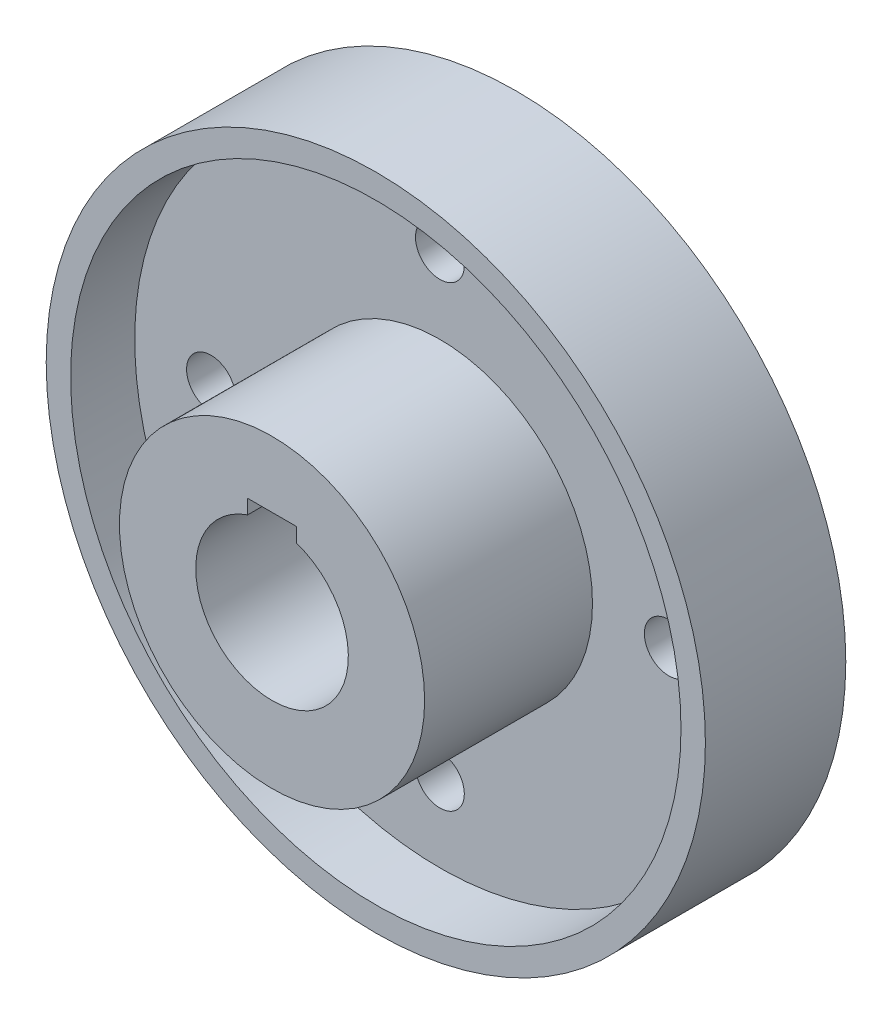
from build123d import *

# Parameters (mm, degrees)
SKETCH1_R           = 50
BOSS_EXTRUDE1_DEPTH = 80
SKETCH2_R           = 108
SKETCH2_R_2         = 50
SKETCH2_R_3         = 8
BOSS_EXTRUDE3_DEPTH = 46
BOSS_EXTRUDE4_START = 5
SKETCH3_R           = 50
BOSS_EXTRUDE4_DEPTH = 5
CHAMFER1_SIZE       = 2
CUT_EXTRUDE1_START  = -21
SKETCH6_R           = 100
SKETCH6_R_2         = 50
CUT_EXTRUDE1_DEPTH  = 21


with BuildPart() as part:
    # Sketch1 → Boss-Extrude1 (new body)
    with BuildSketch(Plane.XY):
        Circle(SKETCH1_R)
        with BuildLine():
            Line((-8, 28.4), (8, 28.4))
            Line((8, 28.4), (8, 23.685438565))
            ThreePointArc((8, 23.685438565), (0, -25), (-8, 23.685438565))
            Line((-8, 23.685438565), (-8, 28.4))
        make_face(mode=Mode.SUBTRACT)
    extrude(amount=BOSS_EXTRUDE1_DEPTH)

    # Sketch2 → Boss-Extrude3 (add)
    with BuildSketch(Plane(origin=(0, 0, 0), x_dir=(-1, 0, 0), z_dir=(0, 0, -1))):
        Circle(SKETCH2_R)
        Circle(SKETCH2_R_2, mode=Mode.SUBTRACT)
        with Locations((0, 75)):
            Circle(SKETCH2_R_3, mode=Mode.SUBTRACT)
        with Locations((75, 0)):
            Circle(SKETCH2_R_3, mode=Mode.SUBTRACT)
        with Locations((0, -75)):
            Circle(SKETCH2_R_3, mode=Mode.SUBTRACT)
        with Locations((-75, 0)):
            Circle(SKETCH2_R_3, mode=Mode.SUBTRACT)
    extrude(amount=-BOSS_EXTRUDE3_DEPTH)

    # Sketch3 → Boss-Extrude4 (add)
    with BuildSketch(Plane(origin=(0, 0, 0), x_dir=(-1, 0, 0), z_dir=(0, 0, -1)).offset(BOSS_EXTRUDE4_START)):
        Circle(SKETCH3_R)
        with BuildLine():
            Line((-8, 23.685438565), (-8, 28.4))
            Line((-8, 28.4), (8, 28.4))
            Line((8, 28.4), (8, 23.685438565))
            ThreePointArc((8, 23.685438565), (0, -25), (-8, 23.685438565))
        make_face(mode=Mode.SUBTRACT)
    extrude(amount=-BOSS_EXTRUDE4_DEPTH)

    # Chamfer1
    chamfer1_edges = [part.edges().sort_by_distance(p)[0] for p in [
        (50, 0, -5),
    ]]
    chamfer(chamfer1_edges, length=CHAMFER1_SIZE)

    # Sketch6 → Cut-Extrude1 (cut)
    with BuildSketch(Plane.XY.offset(46).offset(CUT_EXTRUDE1_START)):
        Circle(SKETCH6_R)
        Circle(SKETCH6_R_2, mode=Mode.SUBTRACT)
    extrude(amount=CUT_EXTRUDE1_DEPTH, mode=Mode.SUBTRACT)


solid = part.part
